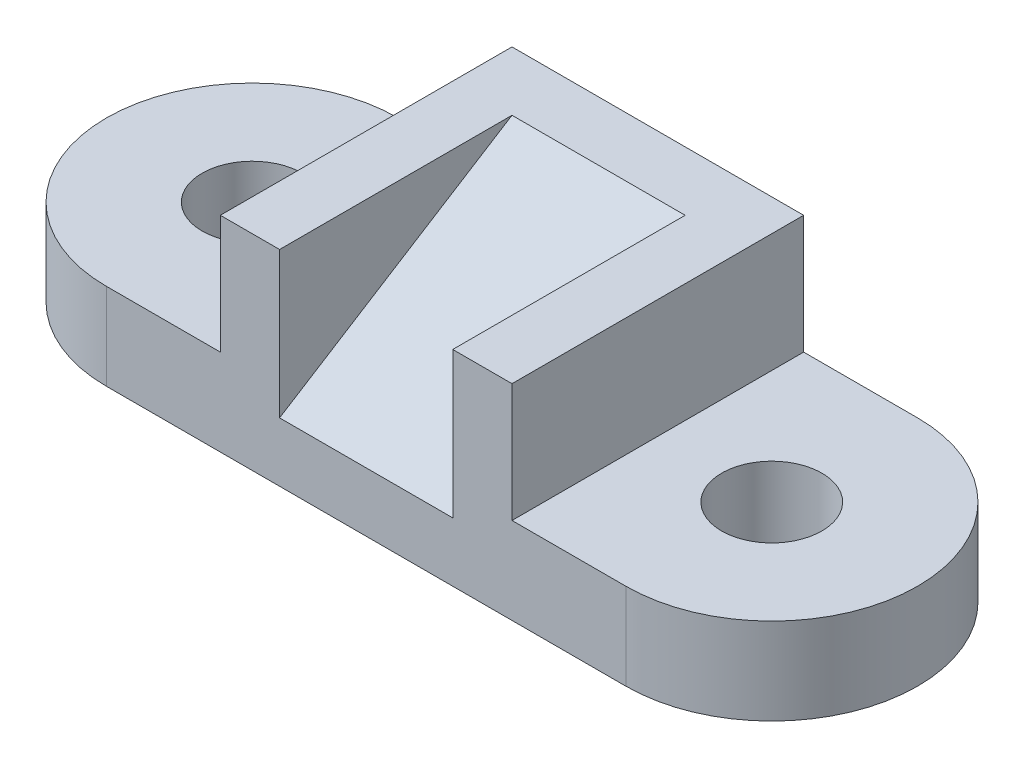
from build123d import *

# Parameters (mm, degrees)
SKETCH1_W           = 64
SKETCH1_H           = 64
BOSS_EXTRUDE1_DEPTH = 45
SKETCH2_R           = 11
BOSS_EXTRUDE4_DEPTH = 19
SKETCH10_W          = 38
SKETCH10_H          = 51
CUT_EXTRUDE5_DEPTH  = 63
SKETCH12_W          = 38
SKETCH12_H          = 51
BOSS_EXTRUDE5_DEPTH = 13
BOSS_EXTRUDE6_DEPTH = 47


with BuildPart() as part:
    # Sketch1 → Boss-Extrude1 (new body)
    with BuildSketch(Plane(origin=(0, 0, 0), x_dir=(1, 0, 0), z_dir=(0, 1, 0))):
        with Locations((32, 32)):
            Rectangle(SKETCH1_W, SKETCH1_H)
    extrude(amount=BOSS_EXTRUDE1_DEPTH)

    # Sketch2 → Boss-Extrude4 (add)
    # profile 1 of 2: a face of its own
    with BuildSketch(Plane(origin=(0, 0, 0), x_dir=(1, 0, 0), z_dir=(0, 1, 0))):
        with BuildLine():
            Line((0, 64), (0, 0))
            Line((0, 0), (-25, 0))
            ThreePointArc((-25, 0), (-57, 32), (-25, 64))
            Line((-25, 64), (0, 64))
        make_face()
        with Locations(Location((-25, 32, 0), (0, 0, 270))):
            Circle(SKETCH2_R, mode=Mode.SUBTRACT)
    # profile 2 of 2: a face of its own
    with BuildSketch(Plane(origin=(0, 0, 0), x_dir=(1, 0, 0), z_dir=(0, 1, 0))):
        with BuildLine():
            Line((89, 0), (64, 0))
            Line((64, 0), (64, 64))
            Line((64, 64), (89, 64))
            ThreePointArc((89, 64), (121, 32), (89, 0))
        make_face()
        with Locations(Location((89, 32, 0), (0, 0, 270))):
            Circle(SKETCH2_R, mode=Mode.SUBTRACT)
    extrude(amount=BOSS_EXTRUDE4_DEPTH)

    # Sketch10 → Cut-Extrude5 (cut)
    with BuildSketch(Plane(origin=(0, 0, 0), x_dir=(1, 0, 0), z_dir=(0, 1, 0))):
        with Locations((32, 25.5)):
            Rectangle(SKETCH10_W, SKETCH10_H)
    extrude(amount=CUT_EXTRUDE5_DEPTH, mode=Mode.SUBTRACT)

    # Sketch12 → Boss-Extrude5 (add)
    with BuildSketch(Plane(origin=(0, 0, 0), x_dir=(1, 0, 0), z_dir=(0, 1, 0))):
        with Locations((32, 25.5)):
            Rectangle(SKETCH12_W, SKETCH12_H)
    extrude(amount=BOSS_EXTRUDE5_DEPTH)

    # Sketch13 → Boss-Extrude6 (add)
    with BuildSketch(Plane(origin=(13, 0, 0), x_dir=(0, 0, -1), z_dir=(1, 0, 0))):
        Polygon((0, 13), (51, 45), (51, 13), align=None)
    extrude(amount=BOSS_EXTRUDE6_DEPTH)


solid = part.part
